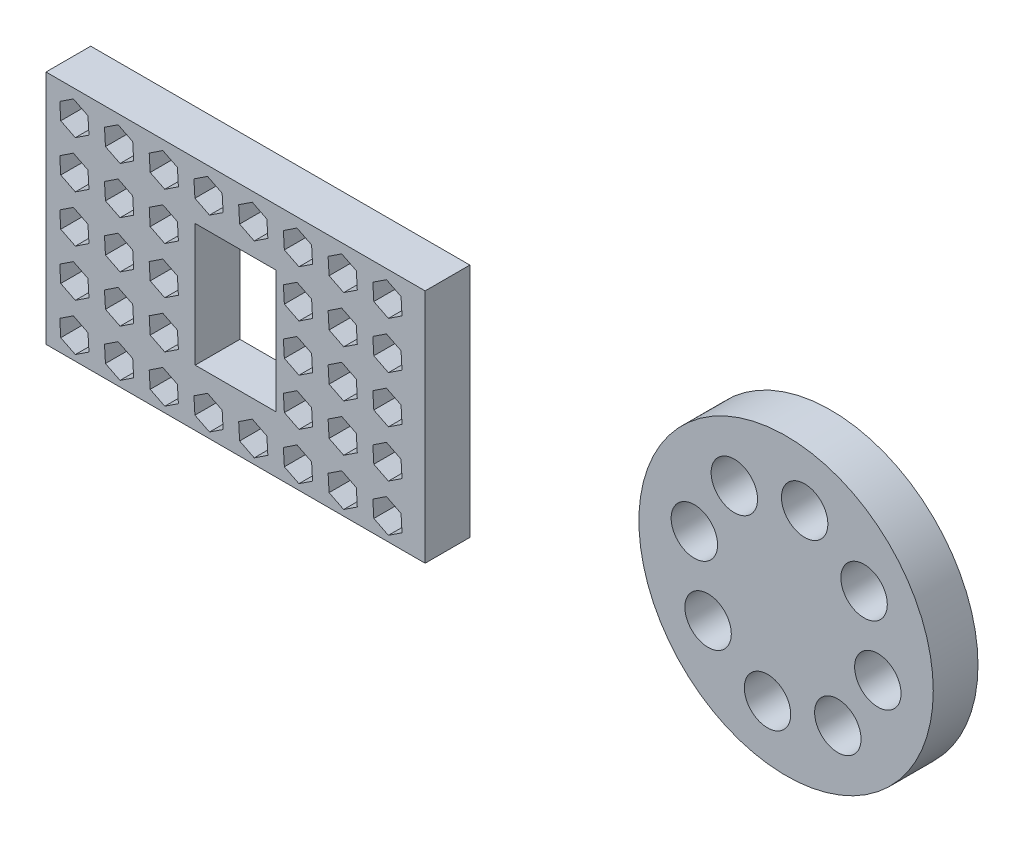
from build123d import *

# Parameters (mm, degrees)
SKETCH1_R             = 32.909432096
SKETCH1_R_2           = 5.189999486
BOSS_EXTRUDE1_DEPTH   = 10
SKETCH1_W             = 84.773358522
SKETCH1_H             = 52.743605416
SKETCH1_W_2           = 18.052103502
SKETCH1_H_2           = 27.434043058
BOSS_EXTRUDE1_2_DEPTH = 10


with BuildPart() as part:
    # Sketch1 → Boss-Extrude1 (new body)
    with BuildSketch(Plane.XY):
        with Locations((123.089976756, 5.73534117)):
            Circle(SKETCH1_R)
        with Locations((143.601965021, 1.585167407)):
            Circle(SKETCH1_R_2, mode=Mode.SUBTRACT)
        with Locations((134.659526742, -11.703440839)):
            Circle(SKETCH1_R_2, mode=Mode.SUBTRACT)
        with Locations((118.939802993, -14.776647095)):
            Circle(SKETCH1_R_2, mode=Mode.SUBTRACT)
        with Locations((105.651194747, -5.834208816)):
            Circle(SKETCH1_R_2, mode=Mode.SUBTRACT)
        with Locations((102.577988491, 9.885514934)):
            Circle(SKETCH1_R_2, mode=Mode.SUBTRACT)
        with Locations((111.52042677, 23.174123179)):
            Circle(SKETCH1_R_2, mode=Mode.SUBTRACT)
        with Locations((127.24015052, 26.247329435)):
            Circle(SKETCH1_R_2, mode=Mode.SUBTRACT)
        with Locations((140.528758765, 17.304891156)):
            Circle(SKETCH1_R_2, mode=Mode.SUBTRACT)
    extrude(amount=BOSS_EXTRUDE1_DEPTH)


with BuildPart() as body_2:
    # Sketch1 → Boss-Extrude1 2 (new body)
    with BuildSketch(Plane.XY):
        Rectangle(SKETCH1_W, SKETCH1_H)
        Polygon((-22.783926752, -23.057213905), (-23.002553749, -19.414832593), (-26.266261994, -17.782978471), (-29.311343242, -19.79350566), (-29.092716244, -23.435886972), (-25.829008, -25.067741094), align=None, mode=Mode.SUBTRACT)
        Polygon((-32.783926752, -23.057213905), (-33.002553749, -19.414832593), (-36.266261994, -17.782978471), (-39.311343242, -19.79350566), (-39.092716244, -23.435886972), (-35.829008, -25.067741094), align=None, mode=Mode.SUBTRACT)
        Polygon((-12.783926752, -23.057213905), (-13.002553749, -19.414832593), (-16.266261994, -17.782978471), (-19.311343242, -19.79350566), (-19.092716244, -23.435886972), (-15.829008, -25.067741094), align=None, mode=Mode.SUBTRACT)
        Polygon((-2.783926752, -23.057213905), (-3.002553749, -19.414832593), (-6.266261994, -17.782978471), (-9.311343242, -19.79350566), (-9.092716244, -23.435886972), (-5.829008, -25.067741094), align=None, mode=Mode.SUBTRACT)
        Polygon((7.216073248, -23.057213905), (6.997446251, -19.414832593), (3.733738006, -17.782978471), (0.688656758, -19.79350566), (0.907283756, -23.435886972), (4.170992, -25.067741094), align=None, mode=Mode.SUBTRACT)
        Polygon((17.216073248, -23.057213905), (16.997446251, -19.414832593), (13.733738006, -17.782978471), (10.688656758, -19.79350566), (10.907283756, -23.435886972), (14.170992, -25.067741094), align=None, mode=Mode.SUBTRACT)
        Polygon((27.216073248, -23.057213905), (26.997446251, -19.414832593), (23.733738006, -17.782978471), (20.688656758, -19.79350566), (20.907283756, -23.435886972), (24.170992, -25.067741094), align=None, mode=Mode.SUBTRACT)
        Polygon((37.216073248, -23.057213905), (36.997446251, -19.414832593), (33.733738006, -17.782978471), (30.688656758, -19.79350566), (30.907283756, -23.435886972), (34.170992, -25.067741094), align=None, mode=Mode.SUBTRACT)
        Polygon((-22.783926752, -12.557213905), (-23.002553749, -8.914832593), (-26.266261994, -7.282978471), (-29.311343242, -9.29350566), (-29.092716244, -12.935886972), (-25.829008, -14.567741094), align=None, mode=Mode.SUBTRACT)
        Polygon((-12.783926752, -12.557213905), (-13.002553749, -8.914832593), (-16.266261994, -7.282978471), (-19.311343242, -9.29350566), (-19.092716244, -12.935886972), (-15.829008, -14.567741094), align=None, mode=Mode.SUBTRACT)
        Polygon((17.216073248, -12.557213905), (16.997446251, -8.914832593), (13.733738006, -7.282978471), (10.688656758, -9.29350566), (10.907283756, -12.935886972), (14.170992, -14.567741094), align=None, mode=Mode.SUBTRACT)
        Polygon((27.216073248, -12.557213905), (26.997446251, -8.914832593), (23.733738006, -7.282978471), (20.688656758, -9.29350566), (20.907283756, -12.935886972), (24.170992, -14.567741094), align=None, mode=Mode.SUBTRACT)
        Polygon((37.216073248, -12.557213905), (36.997446251, -8.914832593), (33.733738006, -7.282978471), (30.688656758, -9.29350566), (30.907283756, -12.935886972), (34.170992, -14.567741094), align=None, mode=Mode.SUBTRACT)
        Polygon((-22.783926752, -2.057213905), (-23.002553749, 1.585167407), (-26.266261994, 3.217021529), (-29.311343242, 1.20649434), (-29.092716244, -2.435886972), (-25.829008, -4.067741094), align=None, mode=Mode.SUBTRACT)
        Polygon((-12.783926752, -2.057213905), (-13.002553749, 1.585167407), (-16.266261994, 3.217021529), (-19.311343242, 1.20649434), (-19.092716244, -2.435886972), (-15.829008, -4.067741094), align=None, mode=Mode.SUBTRACT)
        Polygon((17.216073248, -2.057213905), (16.997446251, 1.585167407), (13.733738006, 3.217021529), (10.688656758, 1.20649434), (10.907283756, -2.435886972), (14.170992, -4.067741094), align=None, mode=Mode.SUBTRACT)
        Polygon((27.216073248, -2.057213905), (26.997446251, 1.585167407), (23.733738006, 3.217021529), (20.688656758, 1.20649434), (20.907283756, -2.435886972), (24.170992, -4.067741094), align=None, mode=Mode.SUBTRACT)
        Polygon((37.216073248, -2.057213905), (36.997446251, 1.585167407), (33.733738006, 3.217021529), (30.688656758, 1.20649434), (30.907283756, -2.435886972), (34.170992, -4.067741094), align=None, mode=Mode.SUBTRACT)
        Polygon((-22.783926752, 8.442786095), (-23.002553749, 12.085167407), (-26.266261994, 13.717021529), (-29.311343242, 11.70649434), (-29.092716244, 8.064113028), (-25.829008, 6.432258906), align=None, mode=Mode.SUBTRACT)
        Polygon((-12.783926752, 8.442786095), (-13.002553749, 12.085167407), (-16.266261994, 13.717021529), (-19.311343242, 11.70649434), (-19.092716244, 8.064113028), (-15.829008, 6.432258906), align=None, mode=Mode.SUBTRACT)
        Polygon((17.216073248, 8.442786095), (16.997446251, 12.085167407), (13.733738006, 13.717021529), (10.688656758, 11.70649434), (10.907283756, 8.064113028), (14.170992, 6.432258906), align=None, mode=Mode.SUBTRACT)
        Polygon((27.216073248, 8.442786095), (26.997446251, 12.085167407), (23.733738006, 13.717021529), (20.688656758, 11.70649434), (20.907283756, 8.064113028), (24.170992, 6.432258906), align=None, mode=Mode.SUBTRACT)
        Polygon((37.216073248, 8.442786095), (36.997446251, 12.085167407), (33.733738006, 13.717021529), (30.688656758, 11.70649434), (30.907283756, 8.064113028), (34.170992, 6.432258906), align=None, mode=Mode.SUBTRACT)
        Polygon((-22.783926752, 18.942786095), (-23.002553749, 22.585167407), (-26.266261994, 24.217021529), (-29.311343242, 22.20649434), (-29.092716244, 18.564113028), (-25.829008, 16.932258906), align=None, mode=Mode.SUBTRACT)
        Polygon((-12.783926752, 18.942786095), (-13.002553749, 22.585167407), (-16.266261994, 24.217021529), (-19.311343242, 22.20649434), (-19.092716244, 18.564113028), (-15.829008, 16.932258906), align=None, mode=Mode.SUBTRACT)
        Polygon((-2.783926752, 18.942786095), (-3.002553749, 22.585167407), (-6.266261994, 24.217021529), (-9.311343242, 22.20649434), (-9.092716244, 18.564113028), (-5.829008, 16.932258906), align=None, mode=Mode.SUBTRACT)
        Polygon((7.216073248, 18.942786095), (6.997446251, 22.585167407), (3.733738006, 24.217021529), (0.688656758, 22.20649434), (0.907283756, 18.564113028), (4.170992, 16.932258906), align=None, mode=Mode.SUBTRACT)
        Polygon((17.216073248, 18.942786095), (16.997446251, 22.585167407), (13.733738006, 24.217021529), (10.688656758, 22.20649434), (10.907283756, 18.564113028), (14.170992, 16.932258906), align=None, mode=Mode.SUBTRACT)
        Polygon((27.216073248, 18.942786095), (26.997446251, 22.585167407), (23.733738006, 24.217021529), (20.688656758, 22.20649434), (20.907283756, 18.564113028), (24.170992, 16.932258906), align=None, mode=Mode.SUBTRACT)
        Polygon((37.216073248, 18.942786095), (36.997446251, 22.585167407), (33.733738006, 24.217021529), (30.688656758, 22.20649434), (30.907283756, 18.564113028), (34.170992, 16.932258906), align=None, mode=Mode.SUBTRACT)
        Polygon((-32.783926752, -12.557213905), (-33.002553749, -8.914832593), (-36.266261994, -7.282978471), (-39.311343242, -9.29350566), (-39.092716244, -12.935886972), (-35.829008, -14.567741094), align=None, mode=Mode.SUBTRACT)
        Polygon((-32.783926752, -2.057213905), (-33.002553749, 1.585167407), (-36.266261994, 3.217021529), (-39.311343242, 1.20649434), (-39.092716244, -2.435886972), (-35.829008, -4.067741094), align=None, mode=Mode.SUBTRACT)
        Polygon((-32.783926752, 8.442786095), (-33.002553749, 12.085167407), (-36.266261994, 13.717021529), (-39.311343242, 11.70649434), (-39.092716244, 8.064113028), (-35.829008, 6.432258906), align=None, mode=Mode.SUBTRACT)
        Polygon((-32.783926752, 18.942786095), (-33.002553749, 22.585167407), (-36.266261994, 24.217021529), (-39.311343242, 22.20649434), (-39.092716244, 18.564113028), (-35.829008, 16.932258906), align=None, mode=Mode.SUBTRACT)
        Rectangle(SKETCH1_W_2, SKETCH1_H_2, mode=Mode.SUBTRACT)
    extrude(amount=BOSS_EXTRUDE1_2_DEPTH)


solid = Compound([part.part, body_2.part])
